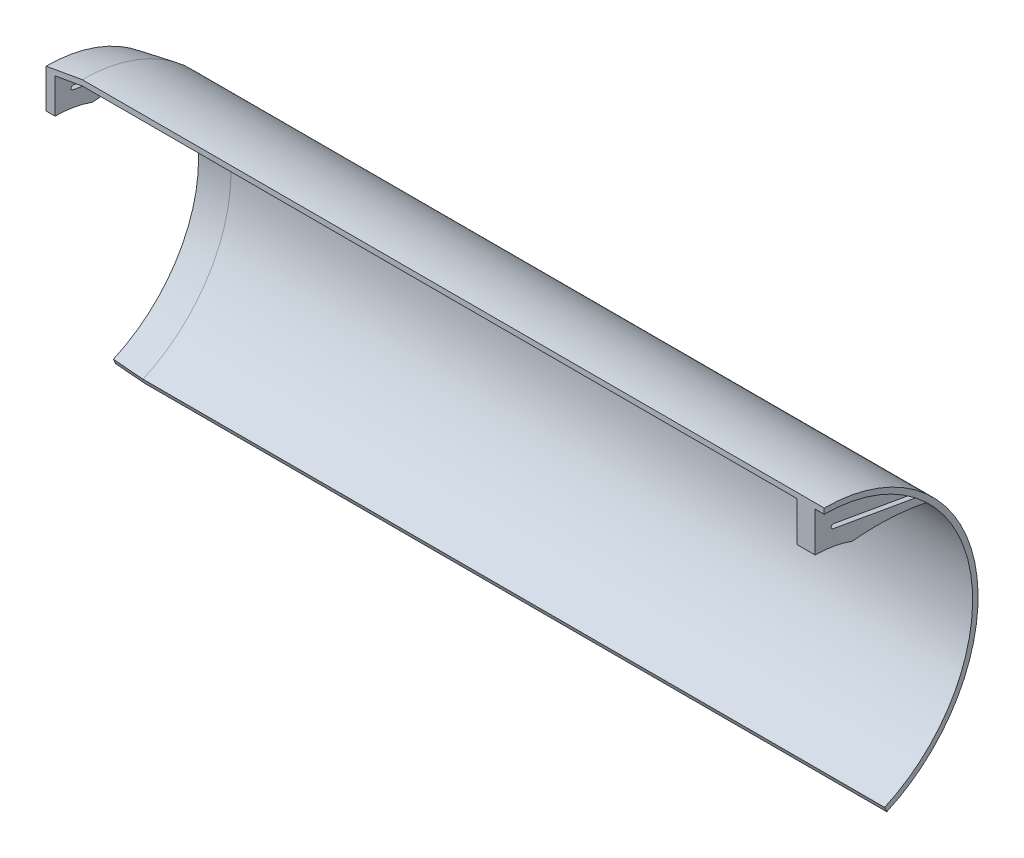
from build123d import *

# Parameters (mm, degrees)
REVOLVE5_ANGLE          = 156
REVOLVE7_ANGLE          = 50
SKETCH4_OUTSIDE_W       = 180.506
SKETCH4_OUTSIDE_H       = 258.157
CUT_EXTRUDE2_DEPTH      = 170
CUT_EXTRUDE3_DEPTH      = 442.672956065
CUT_EXTRUDE3_DEPTH_BACK = 10
SKETCH5_OUTSIDE_W       = 180.506
SKETCH5_OUTSIDE_H       = 258.157


with BuildPart() as part:
    # Sketch1 → Revolve5 (revolve)
    with BuildSketch(Plane.XY):
        with BuildLine():
            Line((560, 85), (150, 85))
            add(Edge.make_bspline(
                [(130, 81.42814839), (131.199611639, 81.653568948), (134.531160345, 82.27353853), (140.063409966, 83.276352633), (145.198462089, 84.177415336), (148.333178957, 84.715838785), (149.39998937, 84.897876633), (149.733326587, 84.954653305), (149.933332963, 84.98866355), (150, 85)],
                knots=[0.892972089, 0.892972089, 0.892972089, 0.892972089, 0.912262482, 0.946527454, 0.981827786, 0.994656092, 0.99679374, 0.998931275, 1, 1, 1, 1], degree=3))
            Line((130, 81.42814839), (130, 60))
            Line((130, 60), (135, 60))
            Line((135, 60), (135, 79.305358628))
            add(Edge.make_bspline(
                [(135, 79.305358628), (135.41688533, 79.381868697), (140.494804486, 80.310770929), (145.581915204, 81.204990099), (150.253322265, 82)],
                knots=[0.916860703, 0.916860703, 0.916860703, 0.916860703, 0.923577482, 0.99866409, 0.99866409, 0.99866409, 0.99866409], degree=3))
            Line((150.253322265, 82), (545, 82))
            Line((545, 82), (545, 60))
            Line((545, 60), (555, 60))
            Line((555, 60), (555, 82))
            Line((555, 82), (560, 82))
            Line((560, 82), (560, 85))
        make_face()
    revolve(axis=Axis((2.999985029, 0, 0), (-1, 0, 0)), revolution_arc=REVOLVE5_ANGLE)

    # Sketch1<9> → Revolve7 (revolve)
    with BuildSketch(Plane.XY):
        with BuildLine():
            Line((560, 85), (150, 85))
            add(Edge.make_bspline(
                [(130, 81.42814839), (131.199611639, 81.653568948), (134.531160345, 82.27353853), (140.063409966, 83.276352633), (145.198462089, 84.177415336), (148.333178957, 84.715838785), (149.39998937, 84.897876633), (149.733326587, 84.954653305), (149.933332963, 84.98866355), (150, 85)],
                knots=[0.892972089, 0.892972089, 0.892972089, 0.892972089, 0.912262482, 0.946527454, 0.981827786, 0.994656092, 0.99679374, 0.998931275, 1, 1, 1, 1], degree=3))
            Line((130, 81.42814839), (130, 78.37548573))
            add(Edge.make_bspline(
                [(130, 78.37548573), (130.416441261, 78.4539748), (131.249429944, 78.610441407), (132.499278387, 78.843638055), (133.749457206, 79.075350404), (134.58311467, 79.228848558), (135, 79.305358628)],
                knots=[0.889993585, 0.889993585, 0.889993585, 0.889993585, 0.896710365, 0.903427144, 0.910143923, 0.916860703, 0.916860703, 0.916860703, 0.916860703], degree=3))
            add(Edge.make_bspline(
                [(135, 79.305358628), (135.41688533, 79.381868697), (140.494804486, 80.310770929), (145.581915204, 81.204990099), (150.253322265, 82)],
                knots=[0.916860703, 0.916860703, 0.916860703, 0.916860703, 0.923577482, 0.99866409, 0.99866409, 0.99866409, 0.99866409], degree=3))
            Line((150.253322265, 82), (545, 82))
            Line((545, 82), (555, 82))
            Line((555, 82), (560, 82))
            Line((560, 82), (560, 85))
        make_face()
    revolve(axis=Axis((2.999985029, 0, 0), (-1, 0, 0)), revolution_arc=REVOLVE7_ANGLE)

    # Sketch4 outside → Cut-Extrude2 (cut)
    with BuildSketch(Plane.ZY.offset(-135)):
        with Locations((-42.5, 3.6745)):
            Rectangle(SKETCH4_OUTSIDE_W, SKETCH4_OUTSIDE_H)
        with BuildLine():
            Line((0, 60), (0, 82.355324155))
            ThreePointArc((0, 82.355324155), (-28.788899936, 77.159566207), (-53.94524406, 62.227888121))
            Line((-53.94524406, 62.227888121), (-10.199695404, 69.941408635))
            ThreePointArc((-10.199695404, 69.941408635), (-8.867471084, 69.008575123), (-9.800304596, 67.676350803))
            Line((-9.800304596, 67.676350803), (-57.112993118, 59.333847287))
            ThreePointArc((-57.112993118, 59.333847287), (-59.561955461, 56.875063765), (-61.905157801, 54.315291165))
            ThreePointArc((-61.905157801, 54.315291165), (-41.293069586, 56.9484186), (-20.5212086, 56.381557247))
            ThreePointArc((-20.5212086, 56.381557247), (-10.41889066, 59.088465181), (0, 60))
        make_face(mode=Mode.SUBTRACT)
    extrude(amount=CUT_EXTRUDE2_DEPTH, mode=Mode.SUBTRACT)

    # Sketch5 outside → Cut-Extrude3 (cut, two sides: drawn at the far end of the back side and taken through both)
    # profile 1 of 2: a face of its own
    with BuildSketch(Plane(origin=(555, 0, 0), x_dir=(0, 0, -1), z_dir=(1, 0, 0)).offset(-CUT_EXTRUDE3_DEPTH_BACK)):
        with Locations((42.5, 3.6745)):
            Rectangle(SKETCH5_OUTSIDE_W, SKETCH5_OUTSIDE_H)
        with BuildLine():
            Line((0, 85), (0, 60))
            ThreePointArc((0, 60), (10.41889066, 59.088465181), (20.5212086, 56.381557247))
            ThreePointArc((20.5212086, 56.381557247), (40.998184687, 56.962818166), (61.326696118, 54.433779432))
            ThreePointArc((61.326696118, 54.433779432), (80.146948816, -17.333972293), (33.352404732, -74.910727527))
            Line((33.352404732, -74.910727527), (34.572614661, -77.6513639))
            ThreePointArc((34.572614661, -77.6513639), (83.142546062, 17.67249372), (0, 85))
        make_face(mode=Mode.SUBTRACT)
    # profile 2 of 2: a face of its own
    with BuildSketch(Plane(origin=(555, 0, 0), x_dir=(0, 0, -1), z_dir=(1, 0, 0)).offset(-CUT_EXTRUDE3_DEPTH_BACK)):
        with BuildLine():
            Line((9.800304596, 67.676350803), (56.482682204, 59.444988107))
            ThreePointArc((56.482682204, 59.444988107), (54.890605033, 60.918153937), (53.260119726, 62.348694026))
            Line((53.260119726, 62.348694026), (10.199695404, 69.941408635))
            ThreePointArc((10.199695404, 69.941408635), (8.867471084, 69.008575123), (9.800304596, 67.676350803))
        make_face()
    extrude(amount=CUT_EXTRUDE3_DEPTH + CUT_EXTRUDE3_DEPTH_BACK, mode=Mode.SUBTRACT)


solid = part.part
